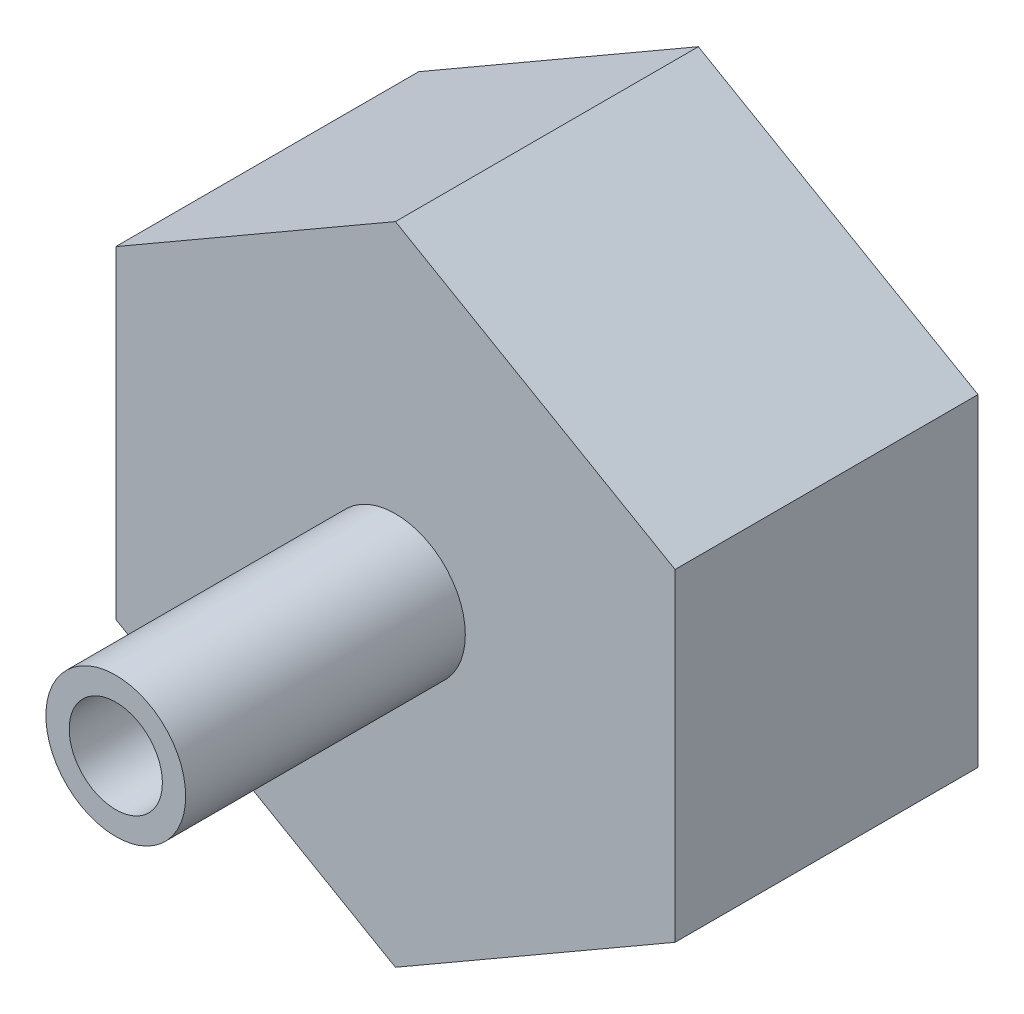
from build123d import *

# Parameters (mm, degrees)
HEX_NUT_DEPTH     = 13
SKETCH2_R         = 10.4775
THREAD_BORE_DEPTH = 11
BARB_START        = 13
SKETCH3_R         = 3
BARB_DEPTH        = 12
SKETCH4_R         = 2
BORE_DEPTH        = 32


with BuildPart() as part:
    # Sketch1 → Hex_Nut (new body)
    with BuildSketch(Plane.XY):
        Polygon((12, 6.92820323), (0, 13.856406461), (-12, 6.92820323), (-12, -6.92820323), (0, -13.856406461), (12, -6.92820323), align=None)
    extrude(amount=HEX_NUT_DEPTH)

    # Sketch2 → Thread_Bore (cut)
    with BuildSketch(Plane.XY):
        Circle(SKETCH2_R)
    extrude(amount=THREAD_BORE_DEPTH, mode=Mode.SUBTRACT)

    # Sketch3 → Barb (add)
    with BuildSketch(Plane.XY.offset(BARB_START)):
        Circle(SKETCH3_R)
    extrude(amount=BARB_DEPTH)

    # Sketch4 → Bore (cut, through all)
    with BuildSketch(Plane.XY):
        Circle(SKETCH4_R)
    extrude(amount=BORE_DEPTH, mode=Mode.SUBTRACT)


solid = part.part
